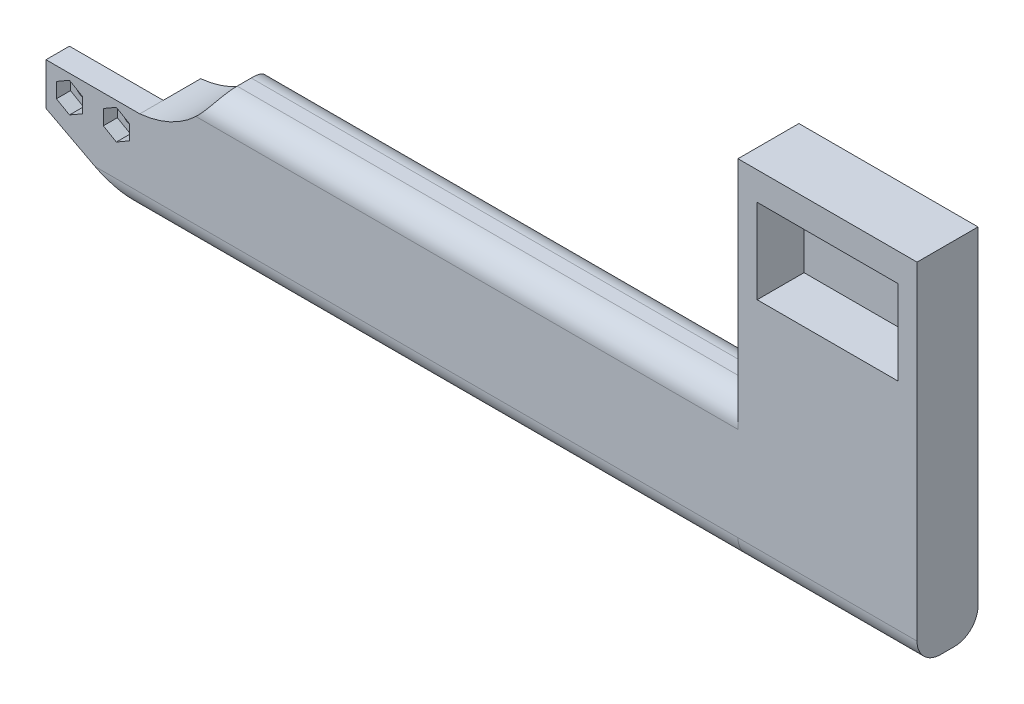
from build123d import *

# Parameters (mm, degrees)
SKETCH1_W           = 20
SKETCH1_H           = 9
BOSS_EXTRUDE1_DEPTH = 5
SKETCH1_4_R         = 1.5
BOSS_EXTRUDE2_DEPTH = 2
BOSS_EXTRUDE3_DEPTH = 13
FILLET2_R           = 5
CUT_EXTRUDE1_DEPTH  = 9.5
SKETCH7_W           = 38.193207509
SKETCH7_H           = 75
SKETCH7_W_2         = 30
SKETCH7_H_2         = 18
BOSS_EXTRUDE7_DEPTH = 13
FILLET3_R           = 5
FILLET4_R           = 5
SKETCH7_3_W         = 30
SKETCH7_3_H         = 18
BOSS_EXTRUDE8_DEPTH = 3


with BuildPart() as part:
    # Sketch1 → Boss-Extrude1 (new body)
    with BuildSketch(Plane.XY):
        with Locations((13.136220239, 112.111863956)):
            Rectangle(SKETCH1_W, SKETCH1_H)
        Polygon((5.361220239, 110.509716959), (5.361220239, 113.714010953), (8.136220239, 115.31615795), (10.911220239, 113.714010953), (10.911220239, 110.509716959), (8.136220239, 108.907569962), align=None, mode=Mode.SUBTRACT)
        Polygon((15.361220239, 110.509716959), (15.361220239, 113.714010953), (18.136220239, 115.31615795), (20.911220239, 113.714010953), (20.911220239, 110.509716959), (18.136220239, 108.907569962), align=None, mode=Mode.SUBTRACT)
    extrude(amount=BOSS_EXTRUDE1_DEPTH)

    # Sketch1<4> → Boss-Extrude2 (add)
    # profile 1 of 2: a face of its own
    with BuildSketch(Plane.XY):
        Polygon((20.911220239, 110.509716959), (20.911220239, 113.714010953), (18.136220239, 115.31615795), (15.361220239, 113.714010953), (15.361220239, 110.509716959), (18.136220239, 108.907569962), align=None)
        with Locations((18.136220239, 112.111863956)):
            Circle(SKETCH1_4_R, mode=Mode.SUBTRACT)
    # profile 2 of 2: a face of its own
    with BuildSketch(Plane.XY):
        Polygon((5.361220239, 113.714010953), (5.361220239, 110.509716959), (8.136220239, 108.907569962), (10.911220239, 110.509716959), (10.911220239, 113.714010953), (8.136220239, 115.31615795), align=None)
        with Locations((8.136220239, 112.111863956)):
            Circle(SKETCH1_4_R, mode=Mode.SUBTRACT)
    extrude(amount=BOSS_EXTRUDE2_DEPTH)

    # Sketch2 → Boss-Extrude3 (add)
    with BuildSketch(Plane.XY.offset(5)):
        with BuildLine():
            Line((23.136220239, 107.611863956), (3.136220239, 107.611863956))
            Line((3.136220239, 107.611863956), (23.136220239, 97.111863956))
            Line((23.136220239, 97.111863956), (188.900832394, 97.111863956))
            Line((188.900832394, 97.111863956), (188.900832394, 127.111863956))
            Line((188.900832394, 127.111863956), (38.900832394, 127.111863956))
            ThreePointArc((38.900832394, 127.111863956), (32.331453067, 119.890646717), (23.136220239, 116.611863956))
            Line((23.136220239, 116.611863956), (23.136220239, 107.611863956))
        make_face()
    extrude(amount=-BOSS_EXTRUDE3_DEPTH)

    # Fillet2
    fillet2_edges = [part.edges().sort_by_distance(p)[0] for p in [
        (113.900832394, 127.111863956, -8),
        (106.018526317, 97.111863956, -8),
        (113.900832394, 127.111863956, 5),
        (106.018526317, 97.111863956, 5),
    ]]
    fillet(fillet2_edges, radius=FILLET2_R)

    # Sketch6 → Cut-Extrude1 (cut)
    with BuildSketch(Plane.XY.offset(5)):
        Polygon((185.900832394, 121.111863956), (155.900832394, 121.111863956), (155.900832394, 103.111863956), (185.900832394, 103.111863956), (185.900832394, 112.111863956), align=None)
    extrude(amount=-CUT_EXTRUDE1_DEPTH, mode=Mode.SUBTRACT)

    # Sketch7 → Boss-Extrude7 (add)
    with BuildSketch(Plane(origin=(0, 0, -8), x_dir=(-1, 0, 0), z_dir=(0, 0, -1))):
        with Locations((-169.80422864, 134.611863956)):
            Rectangle(SKETCH7_W, SKETCH7_H)
        with Locations((-169.804228639, 157.111863956)):
            Rectangle(SKETCH7_W_2, SKETCH7_H_2, mode=Mode.SUBTRACT)
    extrude(amount=-BOSS_EXTRUDE7_DEPTH)

    # Fillet3
    fillet3_edges = [part.edges().sort_by_distance(p)[0] for p in [
        (169.804228639, 97.111863956, 5),
    ]]
    fillet(fillet3_edges, radius=FILLET3_R)

    # Fillet4
    fillet4_edges = [part.edges().sort_by_distance(p)[0] for p in [
        (169.804228639, 97.111863956, -8),
    ]]
    fillet(fillet4_edges, radius=FILLET4_R)

    # Sketch7<3> → Boss-Extrude8 (add)
    with BuildSketch(Plane(origin=(0, 0, -8), x_dir=(-1, 0, 0), z_dir=(0, 0, -1))):
        with Locations((-169.804228639, 157.111863956)):
            Rectangle(SKETCH7_3_W, SKETCH7_3_H)
    extrude(amount=-BOSS_EXTRUDE8_DEPTH)


solid = part.part
